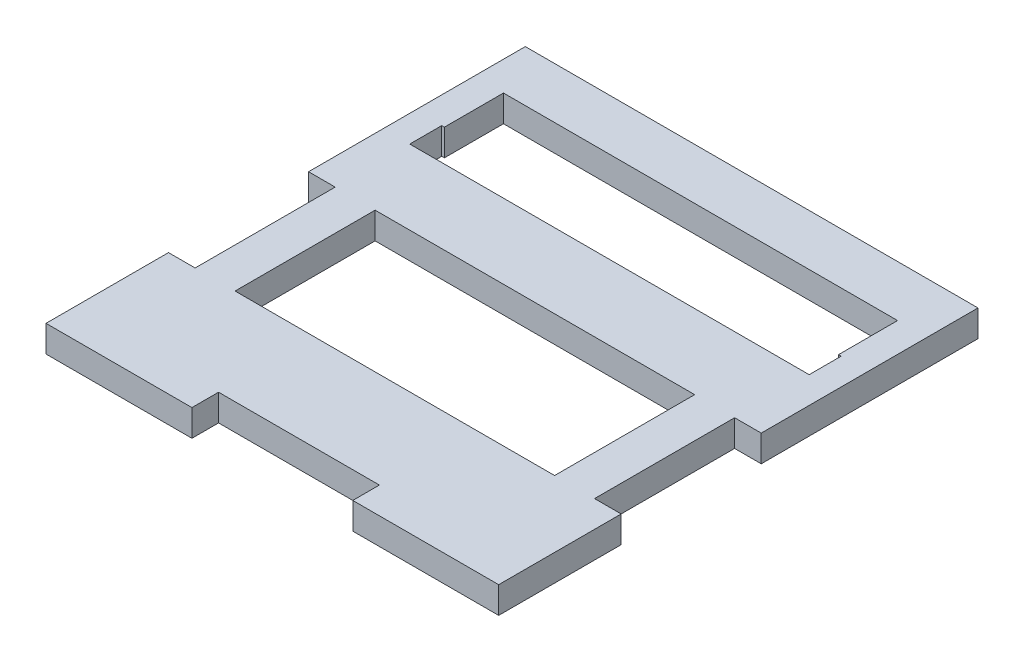
from build123d import *

# Parameters (mm, degrees)
SKETCH1_W           = 85
SKETCH1_H           = 90
BOSS_EXTRUDE1_DEPTH = 5
SKETCH2_W           = 60
SKETCH2_H           = 26.3
CUT_EXTRUDE2_DEPTH  = 7.5
SKETCH4_W           = 5
SKETCH4_H           = 26.3
CUT_EXTRUDE3_DEPTH  = 7.5
SKETCH5_W           = 30.2
SKETCH5_H           = 5
CUT_EXTRUDE4_DEPTH  = 5


with BuildPart() as part:
    # Sketch1 → Boss-Extrude1 (new body)
    with BuildSketch(Plane(origin=(0, 0, 0), x_dir=(1, 0, 0), z_dir=(0, 1, 0))):
        Rectangle(SKETCH1_W, SKETCH1_H)
    extrude(amount=BOSS_EXTRUDE1_DEPTH)

    # Sketch2 → Cut-Extrude2 (cut)
    with BuildSketch(Plane(origin=(0, 5, 0), x_dir=(1, 0, 0), z_dir=(0, 1, 0))):
        with Locations((0, -8.85)):
            Rectangle(SKETCH2_W, SKETCH2_H)
        Polygon((37.5, 24.3), (37, 24.3), (37, 35.4), (-37, 35.4), (-37, 24.3), (-37.5, 24.3), (-37.5, 18.3), (37.5, 18.3), align=None)
    extrude(amount=-CUT_EXTRUDE2_DEPTH, mode=Mode.SUBTRACT)

    # Sketch4 → Cut-Extrude3 (cut)
    with BuildSketch(Plane(origin=(0, 5, 0), x_dir=(1, 0, 0), z_dir=(0, 1, 0))):
        with Locations((-40, -8.85)):
            Rectangle(SKETCH4_W, SKETCH4_H)
        with Locations((40, -8.85)):
            Rectangle(SKETCH4_W, SKETCH4_H)
    extrude(amount=-CUT_EXTRUDE3_DEPTH, mode=Mode.SUBTRACT)

    # Sketch5 → Cut-Extrude4 (cut)
    with BuildSketch(Plane(origin=(0, 5, 0), x_dir=(1, 0, 0), z_dir=(0, 1, 0))):
        with Locations((0, -42.5)):
            Rectangle(SKETCH5_W, SKETCH5_H)
    extrude(amount=-CUT_EXTRUDE4_DEPTH, mode=Mode.SUBTRACT)


solid = part.part
